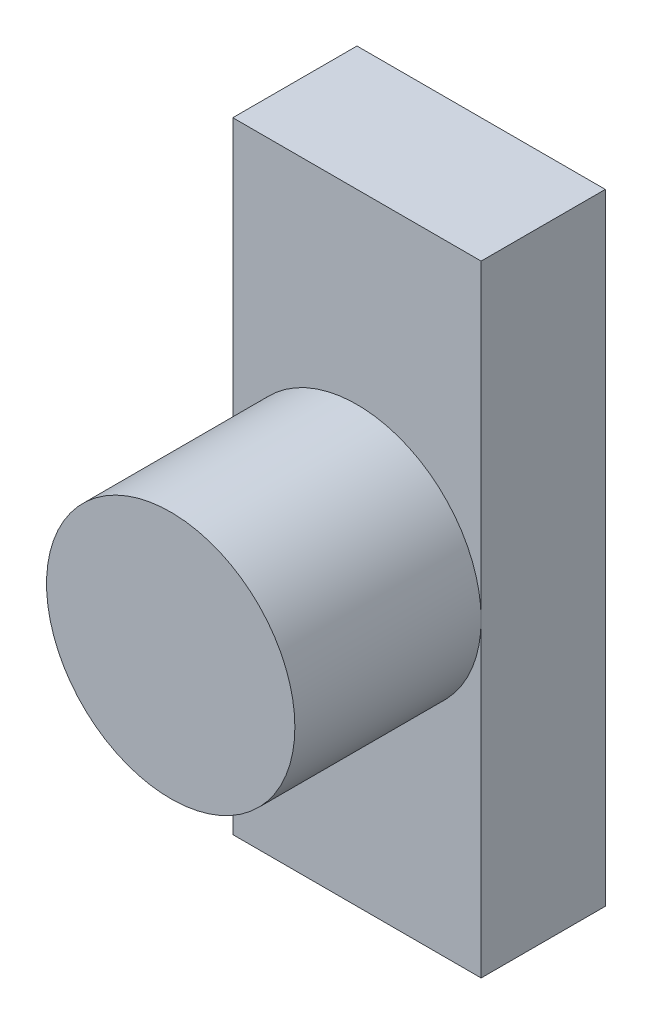
from build123d import *

# Parameters (mm, degrees)
SKETCH1_W           = 4
SKETCH1_H           = 10
BOSS_EXTRUDE1_DEPTH = 2
SKETCH2_R           = 2
BOSS_EXTRUDE2_DEPTH = 3


with BuildPart() as part:
    # Sketch1 → Boss-Extrude1 (new body)
    with BuildSketch(Plane.XY):
        with Locations((-2, 5)):
            Rectangle(SKETCH1_W, SKETCH1_H)
    extrude(amount=BOSS_EXTRUDE1_DEPTH)

    # Sketch2 → Boss-Extrude2 (add)
    with BuildSketch(Plane.XY.offset(2)):
        with Locations((-2, 5)):
            Circle(SKETCH2_R)
    extrude(amount=BOSS_EXTRUDE2_DEPTH)


solid = part.part
